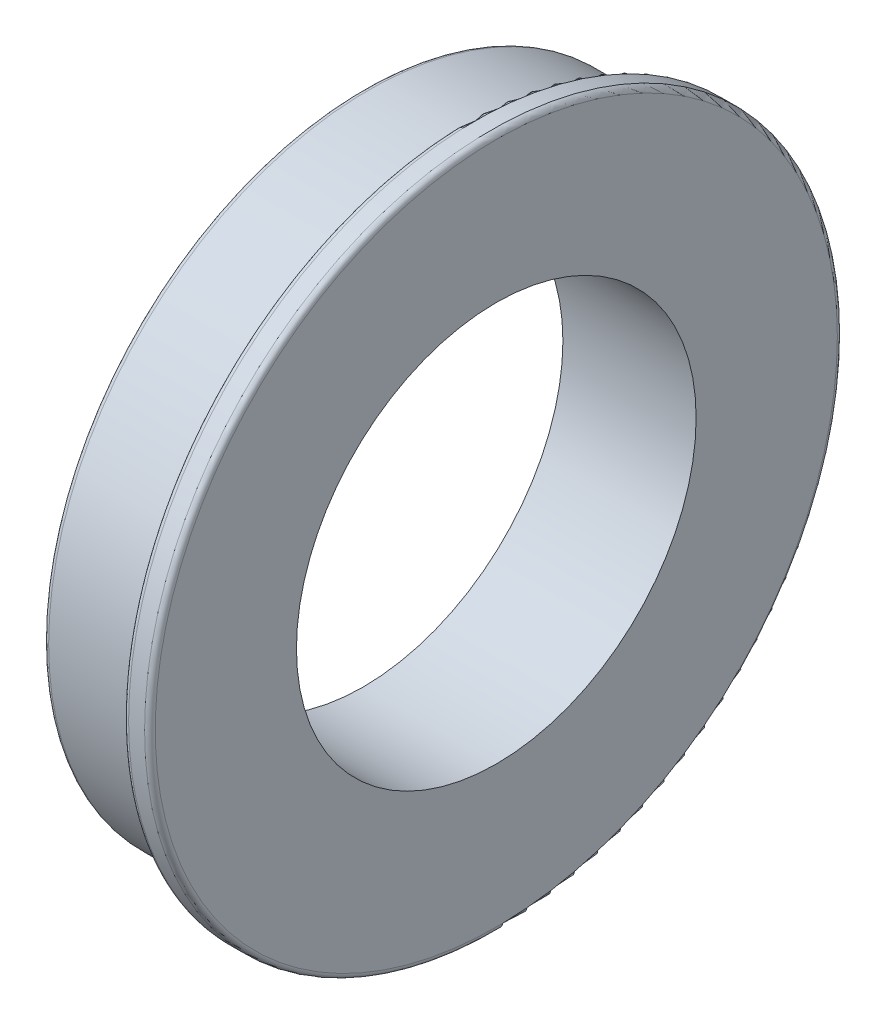
from build123d import *

# Parameters (mm, degrees)
SKETCH_1_R          = 12
EXTRUDE_1_DEPTH     = 4
SKETCH_2_R          = 13
EXTRUDE_2_DEPTH     = 1
SKETCH_3_R          = 7.5
CUT_EXTRUDE_1_DEPTH = 20.052558883
FILLET_1_R          = 0.2


with BuildPart() as part:
    # 草图1 → 凸台-拉伸1 (new body)
    with BuildSketch(Plane(origin=(0, 0, 0), x_dir=(0, 0, -1), z_dir=(1, 0, 0))):
        Circle(SKETCH_1_R)
    extrude(amount=EXTRUDE_1_DEPTH)

    # 草图2 → 凸台-拉伸2 (add)
    with BuildSketch(Plane(origin=(4, 0, 0), x_dir=(0, 0, -1), z_dir=(1, 0, 0))):
        Circle(SKETCH_2_R)
    extrude(amount=EXTRUDE_2_DEPTH)

    # 草图3 → 切除-拉伸1 (cut, through all)
    with BuildSketch(Plane.ZY):
        Circle(SKETCH_3_R)
    extrude(amount=-CUT_EXTRUDE_1_DEPTH, mode=Mode.SUBTRACT)

    # 圆角1
    fillet_1_edges = [part.edges().sort_by_distance(p)[0] for p in [
        (0, 0, 12),
        (4, 0, 13),
        (5, 0, 13),
    ]]
    fillet(fillet_1_edges, radius=FILLET_1_R)


solid = part.part
